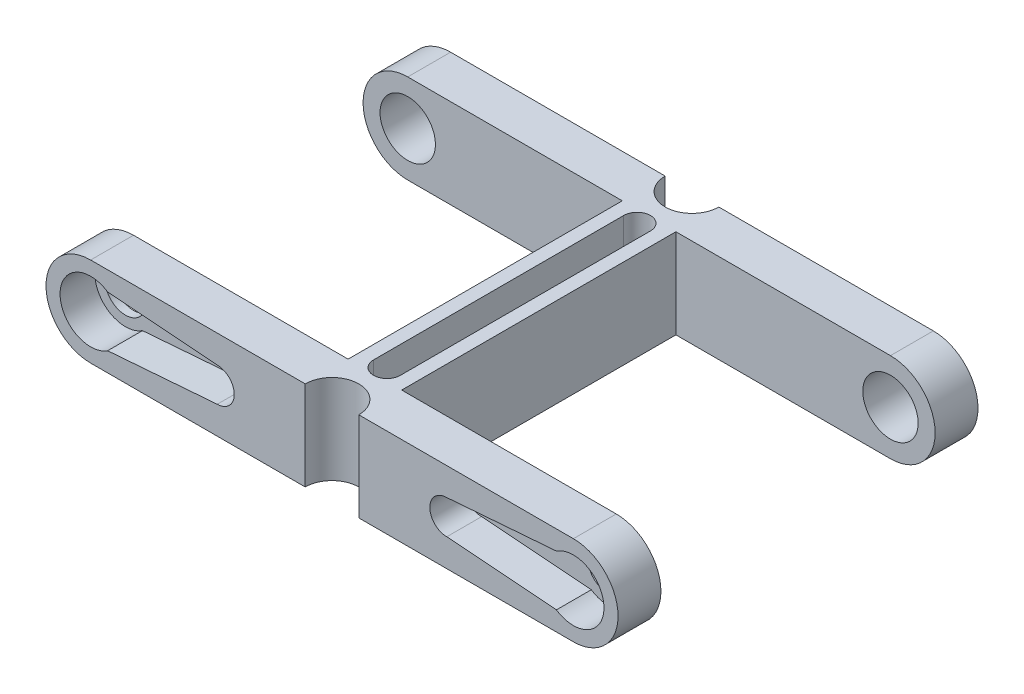
from build123d import *

# Parameters (mm, degrees)
BOSS_EXTRUDE1_DEPTH     = 20.15
CUT_EXTRUDE1_DEPTH      = 40.134529676
CUT_EXTRUDE1_DEPTH_BACK = 40.134529676
SKETCH2_R               = 3
CUT_EXTRUDE2_DEPTH      = 3.9
SKETCH5_R               = 2.3
CUT_EXTRUDE4_DEPTH      = 16.25
CUT_EXTRUDE5_START      = -15.35
SKETCH7_R               = 3.1
CUT_EXTRUDE5_DEPTH      = 23.814268799


with BuildPart() as part:
    # Sketch1 → Boss-Extrude1 (new, symmetric)
    with BuildSketch(Plane.XY):
        with BuildLine():
            Line((-27.023255814, 5), (27.023255814, 5))
            ThreePointArc((27.023255814, 5), (32.023255814, 0), (27.023255814, -5))
            Line((27.023255814, -5), (-27.023255814, -5))
            ThreePointArc((-27.023255814, -5), (-32.023255814, 0), (-27.023255814, 5))
        make_face()
    extrude(amount=BOSS_EXTRUDE1_DEPTH, both=True)

    # Sketch2 → Cut-Extrude1 (cut, two sides: drawn at the far end of the back side and taken through both)
    with BuildSketch(Plane(origin=(0, 5, 0), x_dir=(1, 0, 0), z_dir=(0, 1, 0)).offset(-CUT_EXTRUDE1_DEPTH_BACK)):
        with Locations((0, 20.15)):
            Circle(SKETCH2_R)
        with Locations((0, -20.15)):
            Circle(SKETCH2_R)
        with BuildLine():
            Line((-1.5, -14), (-1.5, 14))
            ThreePointArc((-1.5, 14), (0, 15.5), (1.5, 14))
            Line((1.5, 14), (1.5, -14))
            ThreePointArc((1.5, -14), (0, -15.5), (-1.5, -14))
        make_face()
        Polygon((27.023255814, 15.35), (38.05829872, 15.35), (38.05829872, -15.35), (27.023255814, -15.35), (3, -15.35), (3, 15.35), align=None)
        Polygon((-27.023255814, -15.35), (-38.05829872, -15.35), (-38.05829872, 15.35), (-27.023255814, 15.35), (-3, 15.35), (-3, -15.35), align=None)
    extrude(amount=CUT_EXTRUDE1_DEPTH + CUT_EXTRUDE1_DEPTH_BACK, mode=Mode.SUBTRACT)

    # Sketch4 → Cut-Extrude2 (cut)
    with BuildSketch(Plane.XY.offset(20.15)):
        with BuildLine():
            Line((25.123749299, 2.85), (12.848255814, 1.9))
            ThreePointArc((12.848255814, 1.9), (10.948255814, 0), (12.848255814, -1.9))
            Line((12.848255814, -1.9), (25.123749299, -2.85))
            ThreePointArc((25.123749299, -2.85), (30.448255814, 0), (25.123749299, 2.85))
        make_face()
        with BuildLine():
            Line((-25.123749299, 2.85), (-12.848255814, 1.9))
            ThreePointArc((-12.848255814, 1.9), (-10.948255814, 0), (-12.848255814, -1.9))
            Line((-12.848255814, -1.9), (-25.123749299, -2.85))
            ThreePointArc((-25.123749299, -2.85), (-30.448255814, 0), (-25.123749299, 2.85))
        make_face()
    extrude(amount=-CUT_EXTRUDE2_DEPTH, mode=Mode.SUBTRACT)

    # Sketch5 → Cut-Extrude4 (cut)
    with BuildSketch(Plane.XY):
        with Locations(Location((27.023255814, 0, 0), (0, 0, 180))):
            Circle(SKETCH5_R)
        with Locations(Location((-27.023255814, 0, 0), (0, 0, 180))):
            Circle(SKETCH5_R)
    extrude(amount=CUT_EXTRUDE4_DEPTH, mode=Mode.SUBTRACT)

    # Sketch7 → Cut-Extrude5 (cut, through all)
    with BuildSketch(Plane.XY.offset(CUT_EXTRUDE5_START)):
        with Locations(Location((27.023255814, 0, 0), (0, 0, 180))):
            Circle(SKETCH7_R)
        with Locations(Location((-27.023255814, 0, 0), (0, 0, 180))):
            Circle(SKETCH7_R)
    extrude(amount=-CUT_EXTRUDE5_DEPTH, mode=Mode.SUBTRACT)


solid = part.part
